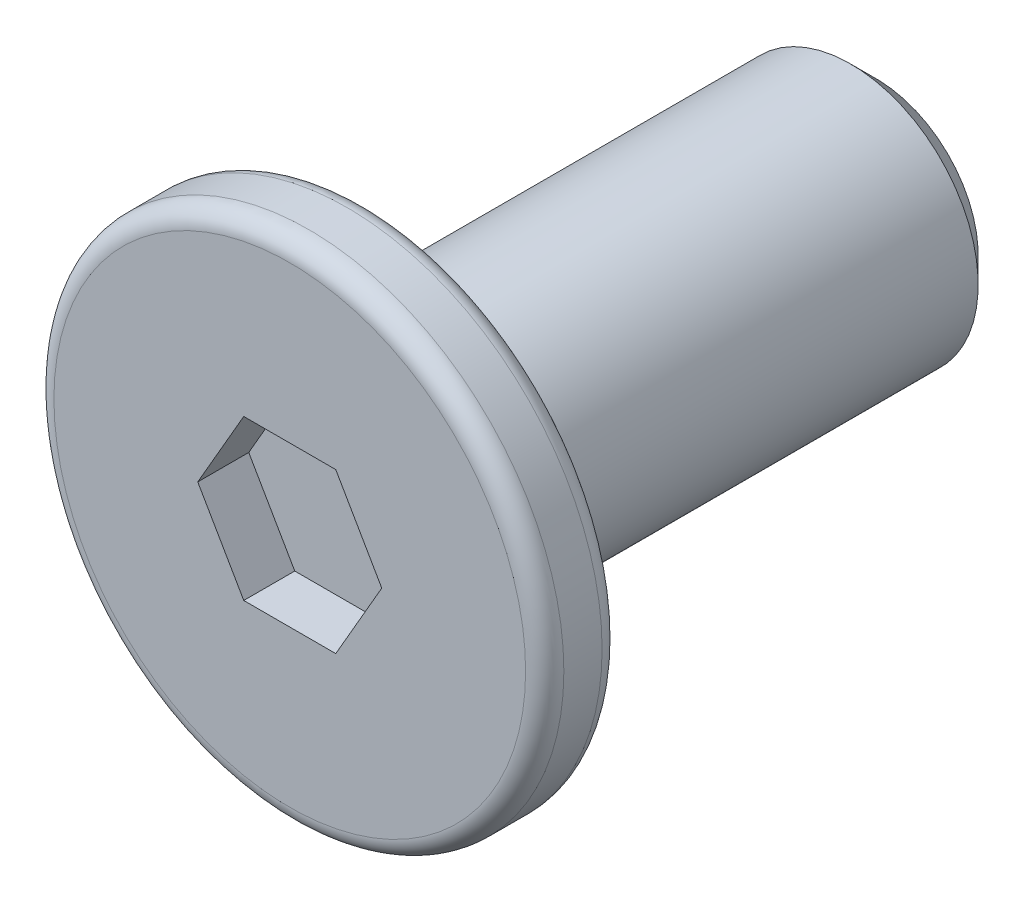
from build123d import *

# Parameters (mm, degrees)
SKETCH_1_R          = 4
EXTRUDE_1_DEPTH     = 0.6
SKETCH_2_R          = 2
EXTRUDE_2_DEPTH     = 8
CHAMFER_1_SIZE      = 0.4
CUT_EXTRUDE_1_DEPTH = 0.8
FILLET_2_R          = 0.3


with BuildPart() as part:
    # 草图1 → 凸台-拉伸1 (new, symmetric)
    with BuildSketch(Plane.XY):
        Circle(SKETCH_1_R)
    extrude(amount=EXTRUDE_1_DEPTH, both=True)

    # 草图2 → 凸台-拉伸2 (add)
    with BuildSketch(Plane(origin=(0, 0, -0.6), x_dir=(-1, 0, 0), z_dir=(0, 0, -1))):
        Circle(SKETCH_2_R)
    extrude(amount=EXTRUDE_2_DEPTH)

    # 倒角1
    chamfer_1_edges = [part.edges().sort_by_distance(p)[0] for p in [
        (2, 0, -8.6),
    ]]
    chamfer(chamfer_1_edges, length=CHAMFER_1_SIZE)

    # 草图3 → 切除-拉伸1 (cut)
    with BuildSketch(Plane.XY.offset(0.6)):
        Polygon((1.443375673, 0), (0.721687836, 1.25), (-0.721687836, 1.25), (-1.443375673, 0), (-0.721687836, -1.25), (0.721687836, -1.25), align=None)
    extrude(amount=-CUT_EXTRUDE_1_DEPTH, mode=Mode.SUBTRACT)

    # 圆角2
    fillet_2_edges = [part.edges().sort_by_distance(p)[0] for p in [
        (-4, 0, -0.6),
        (-4, 0, 0.6),
    ]]
    fillet(fillet_2_edges, radius=FILLET_2_R)


solid = part.part
